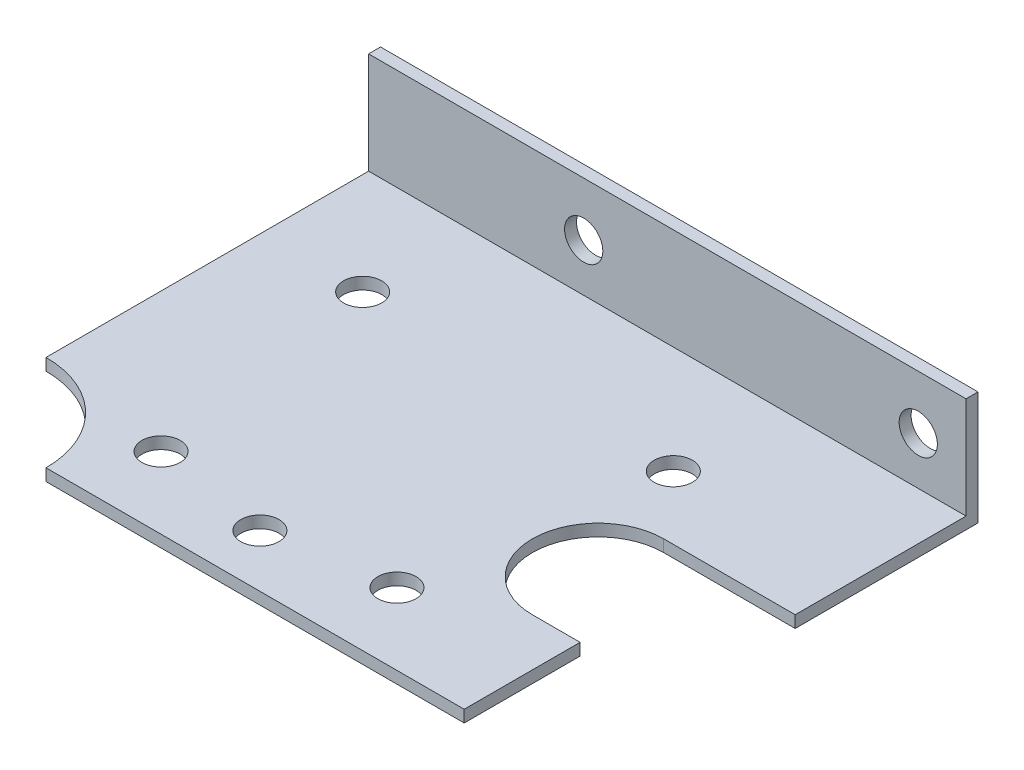
from build123d import *

# Parameters (mm, degrees)
SKETCH_1_R          = 1.6
EXTRUDE_1_DEPTH     = 1
SKETCH_2_W          = 50
SKETCH_2_H          = 1
EXTRUDE_2_DEPTH     = 8.5
SKETCH_3_R          = 1.6
CUT_EXTRUDE_1_DEPTH = 10


with BuildPart() as part:
    # 草图1 → 凸台-拉伸1 (new body)
    with BuildSketch(Plane(origin=(0, 0, 0), x_dir=(1, 0, 0), z_dir=(0, 1, 0))):
        with BuildLine():
            Line((8, 0), (43, 0))
            Line((43, 0), (43, 9.7))
            Line((43, 9.7), (39, 9.7))
            ThreePointArc((39, 9.7), (33.5, 15.2), (39, 20.7))
            Line((39, 20.7), (50, 20.7))
            Line((50, 20.7), (50, 36))
            Line((50, 36), (0, 36))
            Line((0, 36), (0, 8))
            ThreePointArc((0, 8), (5.656854249, 5.656854249), (8, 0))
        make_face()
        with Locations(Location((8.5, 26, 0), (0, 0, 270))):
            Circle(SKETCH_1_R, mode=Mode.SUBTRACT)
        with Locations(Location((21.5, 4.4, 0), (0, 0, 270))):
            Circle(SKETCH_1_R, mode=Mode.SUBTRACT)
        with Locations(Location((34.5, 26, 0), (0, 0, 90))):
            Circle(SKETCH_1_R, mode=Mode.SUBTRACT)
        with Locations(Location((31.371170143, 6, 0), (0, 0, 270))):
            Circle(SKETCH_1_R, mode=Mode.SUBTRACT)
        with Locations(Location((11.628829857, 6, 0), (0, 0, 90))):
            Circle(SKETCH_1_R, mode=Mode.SUBTRACT)
    extrude(amount=EXTRUDE_1_DEPTH)

    # 草图2 → 凸台-拉伸2 (add)
    with BuildSketch(Plane(origin=(0, 1, 0), x_dir=(1, 0, 0), z_dir=(0, 1, 0))):
        with Locations((25, 35.5)):
            Rectangle(SKETCH_2_W, SKETCH_2_H)
    extrude(amount=EXTRUDE_2_DEPTH)

    # 草图3 → 切除-拉伸1 (cut)
    with BuildSketch(Plane.XY.offset(-35)):
        with Locations((46, 5)):
            Circle(SKETCH_3_R)
        with Locations((18, 5)):
            Circle(SKETCH_3_R)
    extrude(amount=-CUT_EXTRUDE_1_DEPTH, mode=Mode.SUBTRACT)


solid = part.part
